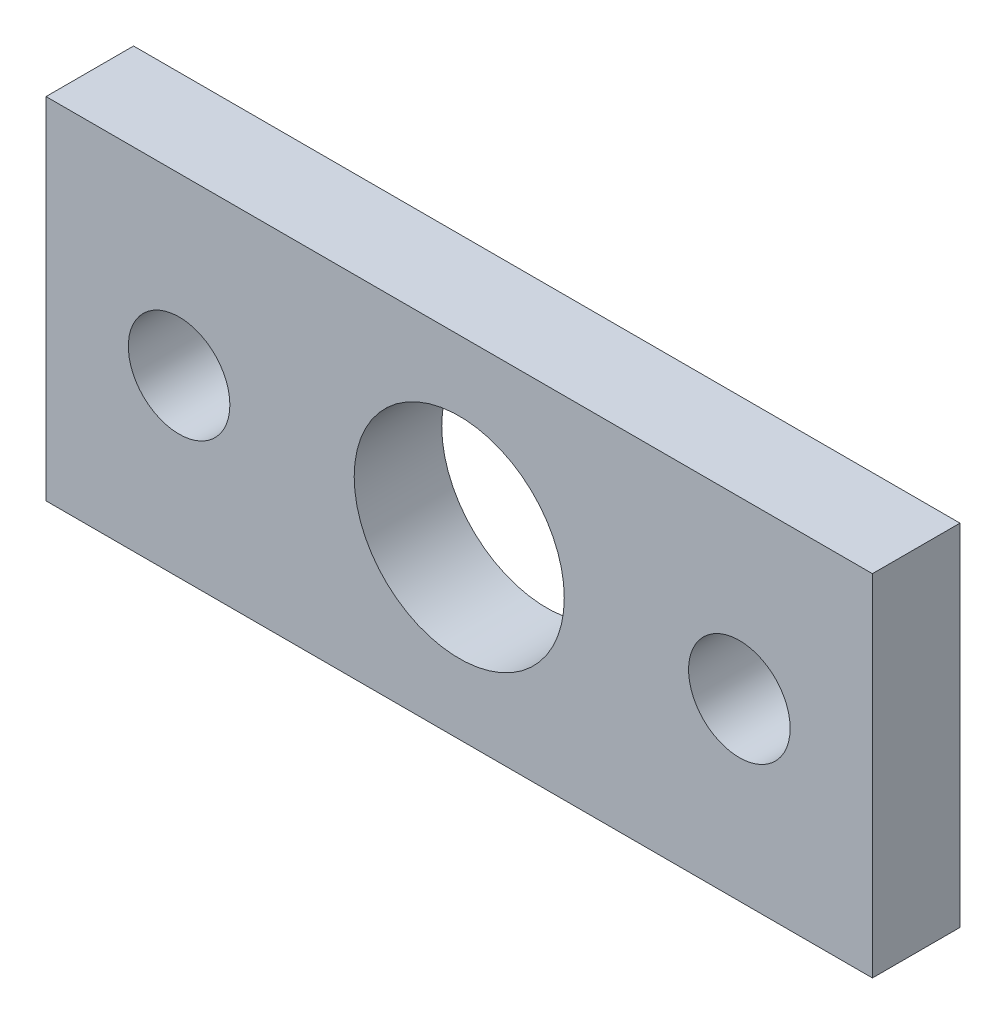
from build123d import *

# Parameters (mm, degrees)
SKETCH_1_W                             = 23.6
SKETCH_1_H                             = 10
SKETCH_1_R                             = 1.45
SKETCH_1_R_2                           = 3
PLATE_23_6X10_T2_5_M2_5_D2_9_P16_DEPTH = 2.5
UNIT_RECESS_RINGS_OD5_6_ID2_9_H1_START = -1
SKETCH_2_R                             = 2.8
SKETCH_2_R_2                           = 1.45
UNIT_RECESS_RINGS_OD5_6_ID2_9_H1_DEPTH = 1


with BuildPart() as part:
    # 草图1 → Plate_23.6x10_T2.5_M2.5_D2.9_P16 (new body)
    with BuildSketch(Plane.XY):
        Rectangle(SKETCH_1_W, SKETCH_1_H)
        with Locations((-8, 0)):
            Circle(SKETCH_1_R, mode=Mode.SUBTRACT)
        with Locations((8, 0)):
            Circle(SKETCH_1_R, mode=Mode.SUBTRACT)
        Circle(SKETCH_1_R_2, mode=Mode.SUBTRACT)
    extrude(amount=PLATE_23_6X10_T2_5_M2_5_D2_9_P16_DEPTH)

    # 草图2 → Unit_recess_rings_OD5.6_ID2.9_H1 (add)
    # profile 1 of 2: a face of its own
    with BuildSketch(Plane.XY.offset(UNIT_RECESS_RINGS_OD5_6_ID2_9_H1_START)):
        with Locations((-8, 0)):
            Circle(SKETCH_2_R)
        with Locations((-8, 0)):
            Circle(SKETCH_2_R_2, mode=Mode.SUBTRACT)
    # profile 2 of 2: a face of its own
    with BuildSketch(Plane.XY.offset(UNIT_RECESS_RINGS_OD5_6_ID2_9_H1_START)):
        with Locations((8, 0)):
            Circle(SKETCH_2_R)
        with Locations((8, 0)):
            Circle(SKETCH_2_R_2, mode=Mode.SUBTRACT)
    extrude(amount=UNIT_RECESS_RINGS_OD5_6_ID2_9_H1_DEPTH)


solid = part.part
